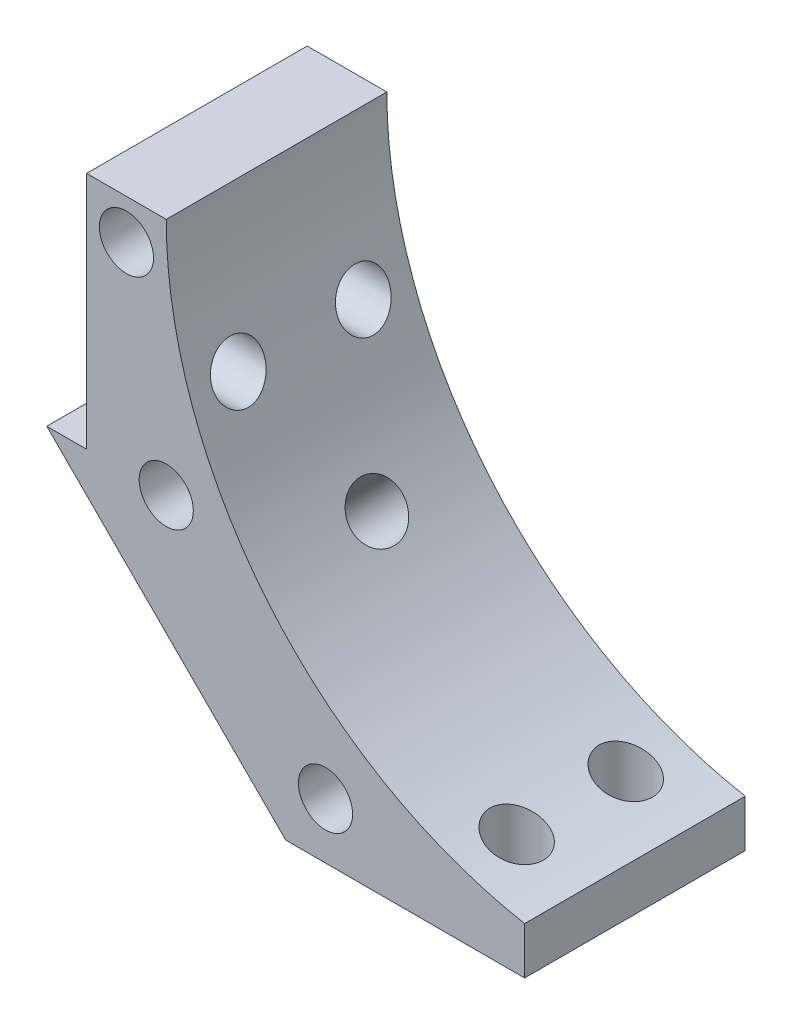
from build123d import *

# Parameters (mm, degrees)
SKETCH_1_W          = 30
SKETCH_1_H          = 30
SKETCH_1_W_2        = 25
EXTRUDE_1_DEPTH     = 27.7
SKETCH_3_R          = 55
CUT_EXTRUDE_1_DEPTH = 40
SKETCH_4_R          = 3.4
CUT_EXTRUDE_2_DEPTH = 90.259677346
SKETCH_5_R          = 3.3
CUT_EXTRUDE_3_DEPTH = 86.978427527
SKETCH_6_R          = 3.35
CUT_EXTRUDE_4_DEPTH = 90.259677512
EXTRUDE_2_DEPTH     = 50
SKETCH_8_R          = 3.4
CUT_EXTRUDE_5_DEPTH = 50
CUT_EXTRUDE_START   = -50
CUT_EXTRUDE_6_DEPTH = 50


with BuildPart() as part:
    # 草图1 → 凸台-拉伸1 (new body)
    with BuildSketch(Plane.XY):
        Polygon((0, 30), (30, 0), (30, 30), align=None)
        with Locations((45, 15)):
            Rectangle(SKETCH_1_W, SKETCH_1_H)
        with Locations((17.5, 45)):
            Rectangle(SKETCH_1_W_2, SKETCH_1_H)
    extrude(amount=EXTRUDE_1_DEPTH)

    # 草图3 → 切除-拉伸1 (cut)
    with BuildSketch(Plane.XY.offset(27.7)):
        with Locations((70, 60)):
            Circle(SKETCH_3_R)
    extrude(amount=-CUT_EXTRUDE_1_DEPTH, mode=Mode.SUBTRACT)

    # 草图4 → 切除-拉伸2 (cut, through all)
    with BuildSketch(Plane.XY.offset(27.7)):
        with Locations((35, 7)):
            Circle(SKETCH_4_R)
        with Locations((10, 55)):
            Circle(SKETCH_4_R)
        with Locations((15, 30)):
            Circle(SKETCH_4_R)
    extrude(amount=-CUT_EXTRUDE_2_DEPTH, mode=Mode.SUBTRACT)

    # 草图5 → 切除-拉伸3 (cut, through all)
    with BuildSketch(Plane.ZY.offset(-5)):
        with Locations(Location((6, 42, 0), (0, 0, 270))):
            Circle(SKETCH_5_R)
        with Locations(Location((21.7, 42, 0), (0, 0, 270))):
            Circle(SKETCH_5_R)
    extrude(amount=-CUT_EXTRUDE_3_DEPTH, mode=Mode.SUBTRACT)

    # 草图6 → 切除-拉伸4 (cut, through all)
    with BuildSketch(Plane.XZ):
        with Locations(Location((52, 20.7, 0), (0, 0, 270))):
            Circle(SKETCH_6_R)
        with Locations(Location((52, 7, 0), (0, 0, 270))):
            Circle(SKETCH_6_R)
    extrude(amount=-CUT_EXTRUDE_4_DEPTH, mode=Mode.SUBTRACT)

    # 草图7 → 凸台-拉伸2 (add)
    with BuildSketch(Plane(origin=(0, 0, 0), x_dir=(-1, 0, 0), z_dir=(0, 0, -1))):
        with BuildLine():
            Line((-5, 60), (-15, 60))
            ThreePointArc((-15, 60), (-27.721163687, 24.821881801), (-60, 5.916730868))
            Line((-60, 5.916730868), (-60, 0))
            Line((-60, 0), (-30, 0))
            Line((-30, 0), (0, 30))
            Line((0, 30), (-5, 30))
            Line((-5, 30), (-5, 60))
        make_face()
    extrude(amount=EXTRUDE_2_DEPTH)

    # 草图8 → 切除-拉伸5 (cut)
    with BuildSketch(Plane(origin=(15, 15, 0), x_dir=(0, 0, 1), z_dir=(-0.7071067811865477, -0.7071067811865475, 0))):
        with BuildLine():
            ThreePointArc((16.1, 0), (12.7, 3.4), (9.3, 0))
            Line((9.3, 0), (16.1, 0))
        make_face()
        with BuildLine():
            Line((16.1, 0), (9.3, 0))
            ThreePointArc((9.3, 0), (12.7, -3.4), (16.1, 0))
        make_face()
        with Locations(Location((-40, 10, 0), (0, 0, 270))):
            Circle(SKETCH_8_R)
        with Locations(Location((-20, 10, 0), (0, 0, 270))):
            Circle(SKETCH_8_R)
        with Locations(Location((-40, -10, 0), (0, 0, 270))):
            Circle(SKETCH_8_R)
        with Locations(Location((-20, -10, 0), (0, 0, 270))):
            Circle(SKETCH_8_R)
    extrude(amount=-CUT_EXTRUDE_5_DEPTH, mode=Mode.SUBTRACT)

    # 草图9 → 切除-拉伸6 (cut)
    with BuildSketch(Plane(origin=(0, 0, -50), x_dir=(-1, 0, 0), z_dir=(0, 0, -1)).offset(CUT_EXTRUDE_START)):
        with BuildLine():
            Line((-5, 30), (-5, 60))
            Line((-5, 60), (-15, 60))
            ThreePointArc((-15, 60), (-27.721163687, 24.821881801), (-60, 5.916730868))
            Line((-60, 5.916730868), (-60, 0))
            Line((-60, 0), (-30, 0))
            Line((-30, 0), (0, 30))
            Line((0, 30), (-5, 30))
        make_face()
    extrude(amount=CUT_EXTRUDE_6_DEPTH, mode=Mode.SUBTRACT)


solid = part.part
